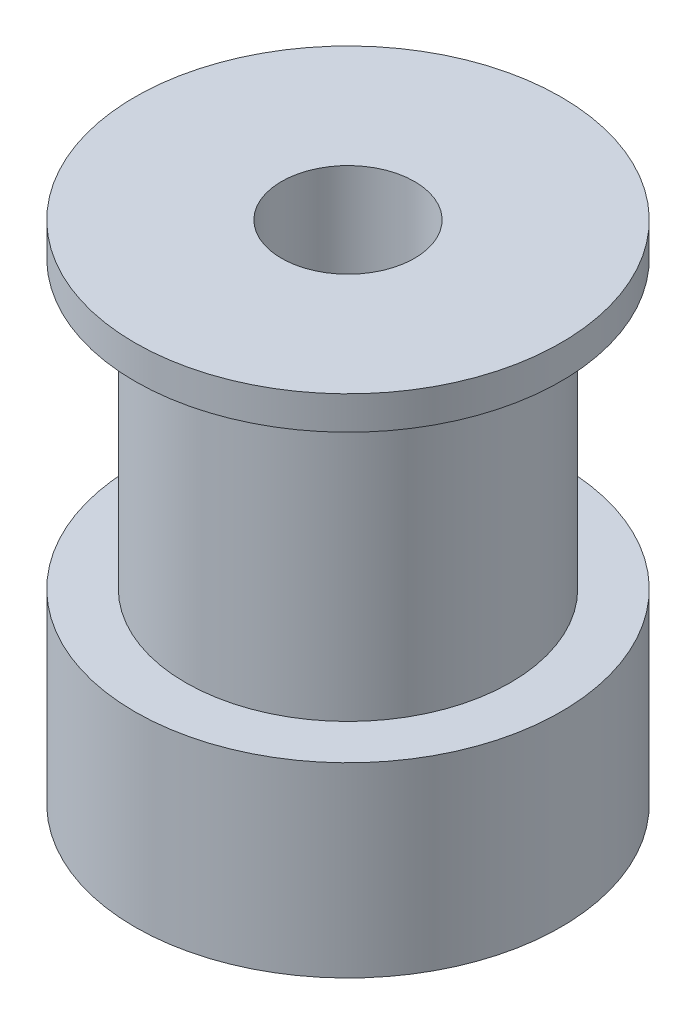
from build123d import *


with BuildPart() as part:
    # Sketch1 → Revolve1 (revolve)
    with BuildSketch(Plane.XY, mode=Mode.PRIVATE) as revolve1_sk:
        Polygon((2.5, 0), (2.5, 19), (8, 19), (8, 17.75), (6.1, 17.75), (6.1, 7), (8, 7), (8, 0), align=None)
    revolve(revolve1_sk.sketch.rotate(Axis((0, 0, 0), (0, 1, 0)), 90), axis=Axis((0, 0, 0), (0, 1, 0)))


solid = part.part
